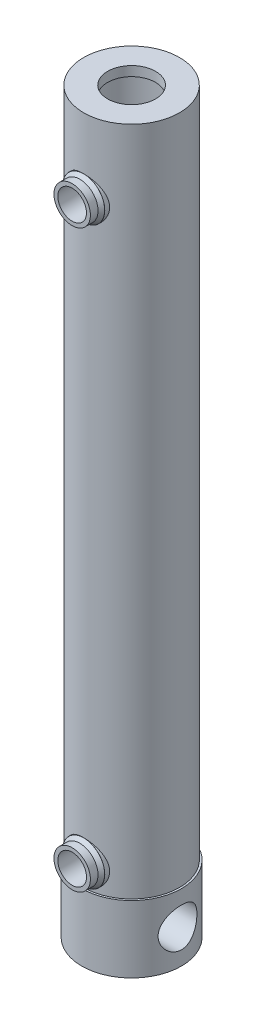
from build123d import *
from OCP.BRepFilletAPI import BRepFilletAPI_MakeChamfer

# Parameters (mm, degrees)
ESQUISSE2_R                  = 26
BOSS_EXTRU_1_DEPTH           = 35
ESQUISSE3_R                  = 7.475
ENL_V_MAT_EXTRU_2_DEPTH      = 352.926128612
ENL_V_MAT_EXTRU_3_DEPTH      = 352.926128712
ENL_V_MAT_EXTRU_3_DEPTH_BACK = 352.926128712
ESQUISSE4_R                  = 10.125
BOSS_EXTRU_2_START           = -2.550056
ESQUISSE5_R                  = 11
ESQUISSE5_R_2                = 7.475
BOSS_EXTRU_2_DEPTH           = 2.550056
ESQUISSE6_R                  = 9.5
ESQUISSE6_R_2                = 7.475
BOSS_EXTRU_3_DEPTH           = 6
CHANFREIN2_SIZE              = 2
CHANFREIN2_SIZE2             = 1.453085056


with BuildPart() as part:
    # Esquisse1 → Révolution1 (revolve)
    with BuildSketch(Plane.XY):
        Polygon((0, 0), (25, 0), (25, 350), (12.5, 350), (12.5, 345), (20, 345), (20, 3), (0, 3), align=None)
    revolve(axis=Axis((0, 3, 0), (0, 1, 0)))

    # Esquisse2 → Boss.-Extru.1 (add)
    with BuildSketch(Plane(origin=(0, 0, 0), x_dir=(-1, 0, 0), z_dir=(0, -1, 0))):
        with Locations(Location((0, 0, 0), (0, 0, 180))):
            Circle(ESQUISSE2_R)
    extrude(amount=BOSS_EXTRU_1_DEPTH)

    # Esquisse3 → Enlèv. mat.-Extru.2 (cut, through all)
    with BuildSketch(Plane.XY):
        with Locations(Location((0, 11.5, 0), (0, 0, 180))):
            Circle(ESQUISSE3_R)
        with Locations(Location((0, 311.5, 0), (0, 0, 180))):
            Circle(ESQUISSE3_R)
    extrude(amount=ENL_V_MAT_EXTRU_2_DEPTH, mode=Mode.SUBTRACT)

    # Esquisse4 → Enlèv. mat.-Extru.3 (cut, two sides: drawn at the far end of the back side and taken through both)
    with BuildSketch(Plane(origin=(0, 0, 0), x_dir=(0, 0, -1), z_dir=(1, 0, 0)).offset(-ENL_V_MAT_EXTRU_3_DEPTH_BACK)):
        with Locations(Location((0, -17.5, 0), (0, 0, 270))):
            Circle(ESQUISSE4_R)
    extrude(amount=ENL_V_MAT_EXTRU_3_DEPTH + ENL_V_MAT_EXTRU_3_DEPTH_BACK, mode=Mode.SUBTRACT)

    # Esquisse5 → Boss.-Extru.2 (add)
    # profile 1 of 2: a face of its own
    with BuildSketch(Plane.XY.offset(25).offset(BOSS_EXTRU_2_START)):
        with Locations((0, 311.5)):
            Circle(ESQUISSE5_R)
        with Locations(Location((0, 311.5, 0), (0, 0, 180))):
            Circle(ESQUISSE5_R_2, mode=Mode.SUBTRACT)
    # profile 2 of 2: a face of its own
    with BuildSketch(Plane.XY.offset(25).offset(BOSS_EXTRU_2_START)):
        with Locations((0, 11.5)):
            Circle(ESQUISSE5_R)
        with Locations(Location((0, 11.5, 0), (0, 0, 180))):
            Circle(ESQUISSE5_R_2, mode=Mode.SUBTRACT)
    extrude(amount=BOSS_EXTRU_2_DEPTH)

    # Esquisse6 → Boss.-Extru.3 (add)
    # profile 1 of 2: a face of its own
    with BuildSketch(Plane.XY.offset(25)):
        with Locations((0, 311.5)):
            Circle(ESQUISSE6_R)
        with Locations(Location((0, 311.5, 0), (0, 0, 180))):
            Circle(ESQUISSE6_R_2, mode=Mode.SUBTRACT)
    # profile 2 of 2: a face of its own
    with BuildSketch(Plane.XY.offset(25)):
        with Locations((0, 11.5)):
            Circle(ESQUISSE6_R)
        with Locations(Location((0, 11.5, 0), (0, 0, 180))):
            Circle(ESQUISSE6_R_2, mode=Mode.SUBTRACT)
    extrude(amount=BOSS_EXTRU_3_DEPTH)

    # Chanfrein2: one chamfer whose edges measure the first distance from different faces: ONE call of the kernel's chamfer builder (chamfer() names one face for all edges)
    chanfrein2_edges_1 = [part.edges().sort_by_distance(p)[0] for p in [
        (6.717514421, 304.782485579, 25),
    ]]
    chanfrein2_side_1 = [part.faces().sort_by_distance(p)[0] for p in [
        (-9.5, 311.5, 28),
    ]]
    chanfrein2_edges_2 = [part.edges().sort_by_distance(p)[0] for p in [
        (6.717514421, 4.782485579, 25),
    ]]
    chanfrein2_side_2 = [part.faces().sort_by_distance(p)[0] for p in [
        (-9.5, 11.5, 28),
    ]]
    chanfrein2 = BRepFilletAPI_MakeChamfer(part.part.solid().wrapped)
    for e in chanfrein2_edges_1:
        chanfrein2.Add(CHANFREIN2_SIZE, CHANFREIN2_SIZE2, e.wrapped, chanfrein2_side_1[0].wrapped)  # the first distance lies on this face
    for e in chanfrein2_edges_2:
        chanfrein2.Add(CHANFREIN2_SIZE, CHANFREIN2_SIZE2, e.wrapped, chanfrein2_side_2[0].wrapped)  # the first distance lies on this face
    add(Compound.cast(chanfrein2.Shape()), mode=Mode.REPLACE)


solid = part.part
